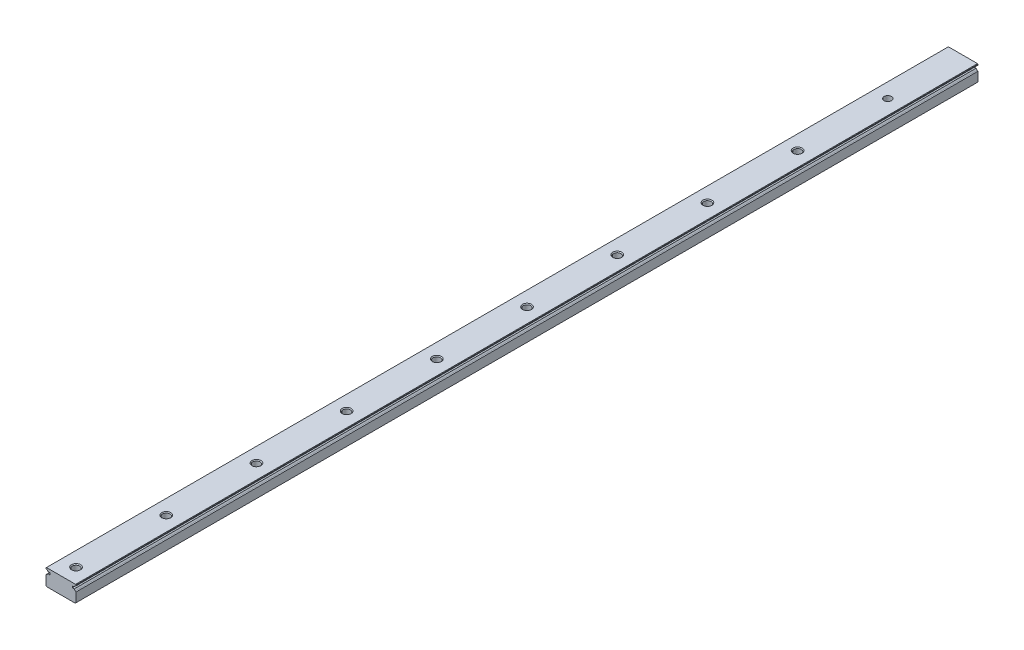
from build123d import *

# Parameters (mm, degrees)
ESQUISSE1_W                = 20
ESQUISSE1_H                = 600
BOSS_EXTRU_1_DEPTH         = 11
ENL_V_MAT_EXTRU_1_DEPTH    = 601.184138411
ENL_V_MAT_EXTRU_2_DEPTH    = 601.184138411
ENL_V_MAT_EXTRU_3_DEPTH    = 601.184138411
ENL_V_MAT_EXTRU_4_DEPTH    = 601.184138411
PER_AGE1_D                 = 4.917
PER_AGE2_D                 = 4.917
CHANFREIN1_SIZE            = 0.5415
CHANFREIN2_SIZE            = 0.3
R_P_TITION_LIN_AIRE1_COUNT = 9
R_P_TITION_LIN_AIRE1_PITCH = 60


with BuildPart() as part:
    # Esquisse1 → Boss.-Extru.1 (new body)
    with BuildSketch(Plane.XZ):
        with Locations((0, -50)):
            Rectangle(ESQUISSE1_W, ESQUISSE1_H)
    extrude(amount=-BOSS_EXTRU_1_DEPTH)

    # Esquisse2 → Enlèv. mat.-Extru.1 (cut, through all)
    with BuildSketch(Plane(origin=(0, 0, -350), x_dir=(-1, 0, 0), z_dir=(0, 0, -1))):
        with BuildLine():
            Line((10, 7.9), (10, 10.22385))
            Line((10, 10.22385), (9.440021531, 9.900556887))
            ThreePointArc((9.440021531, 9.900556887), (9.015681976, 9.557293765), (8.71772889, 9.1))
            Line((8.71772889, 9.1), (7.5, 9.1))
            Line((7.5, 9.1), (7.5, 7.9))
            Line((7.5, 7.9), (10, 7.9))
        make_face()
    extrude(amount=-ENL_V_MAT_EXTRU_1_DEPTH, mode=Mode.SUBTRACT)

    # Esquisse3 → Enlèv. mat.-Extru.2 (cut, through all)
    with BuildSketch(Plane(origin=(0, 0, -350), x_dir=(-1, 0, 0), z_dir=(0, 0, -1))):
        with BuildLine():
            Line((9.440021531, 7.099443113), (10, 6.77615))
            Line((10, 6.77615), (10, 7.9))
            Line((10, 7.9), (8.71772889, 7.9))
            ThreePointArc((8.71772889, 7.9), (9.015681976, 7.442706235), (9.440021531, 7.099443113))
        make_face()
    extrude(amount=-ENL_V_MAT_EXTRU_2_DEPTH, mode=Mode.SUBTRACT)

    # Esquisse4 → Enlèv. mat.-Extru.3 (cut, through all)
    with BuildSketch(Plane(origin=(0, 0, -350), x_dir=(-1, 0, 0), z_dir=(0, 0, -1))):
        with BuildLine():
            Line((-10, 9.1), (-10, 6.77615))
            Line((-10, 6.77615), (-9.440021531, 7.099443113))
            ThreePointArc((-9.440021531, 7.099443113), (-9.015681976, 7.442706235), (-8.71772889, 7.9))
            Line((-8.71772889, 7.9), (-7.5, 7.9))
            Line((-7.5, 7.9), (-7.5, 9.1))
            Line((-7.5, 9.1), (-10, 9.1))
        make_face()
    extrude(amount=-ENL_V_MAT_EXTRU_3_DEPTH, mode=Mode.SUBTRACT)

    # Esquisse5 → Enlèv. mat.-Extru.4 (cut, through all)
    with BuildSketch(Plane(origin=(0, 0, -350), x_dir=(-1, 0, 0), z_dir=(0, 0, -1))):
        with BuildLine():
            Line((-9.440021531, 9.900556887), (-10, 10.22385))
            Line((-10, 10.22385), (-10, 9.1))
            Line((-10, 9.1), (-8.71772889, 9.1))
            ThreePointArc((-8.71772889, 9.1), (-9.015681976, 9.557293765), (-9.440021531, 9.900556887))
        make_face()
    extrude(amount=-ENL_V_MAT_EXTRU_4_DEPTH, mode=Mode.SUBTRACT)

    # Perçage1 (through all)
    with Locations(Plane(origin=(0, 11, 0), x_dir=(1, 0, 0), z_dir=(0, 1, 0))):
        with Locations((0, -180), (0, -120), (0, 60), (0, 180)):
            Hole(PER_AGE1_D / 2)

    # Perçage2 (through all)
    with Locations(Plane(origin=(0, 0, 0), x_dir=(-1, 0, 0), z_dir=(0, -1, 0))):
        with Locations((0, -240), (0, -60), (0, 0), (0, 120), (0, 240)):
            per_age2 = Hole(PER_AGE2_D / 2)

    # Chanfrein1
    chanfrein1_edges = [part.edges().sort_by_distance(p)[0] for p in [
        (2.4585, 11, 180),
        (2.4585, 0, 180),
        (-2.4585, 0, -240),
        (-2.4585, 11, -240),
        (-2.4585, 0, -120),
        (-2.4585, 11, -120),
        (-2.4585, 0, 0),
        (-2.4585, 11, 0),
        (-2.4585, 0, 60),
        (-2.4585, 11, 60),
        (-2.4585, 0, 240),
        (-2.4585, 11, 240),
        (10, 0, -50),
        (-10, 0, -50),
        (2.4585, 11, -180),
        (2.4585, 0, -180),
        (2.4585, 11, -60),
        (2.4585, 0, -60),
        (2.4585, 11, 120),
        (2.4585, 0, 120),
    ]]
    chamfer(chanfrein1_edges, length=CHANFREIN1_SIZE)

    # Chanfrein2
    chanfrein2_edges = [part.edges().sort_by_distance(p)[0] for p in [
        (10, 11, -50),
        (-10, 11, -50),
    ]]
    chamfer(chanfrein2_edges, length=CHANFREIN2_SIZE)

    # Répétition linéaire1: Perçage2 ×9
    with Locations(*[(0, 0, -i * R_P_TITION_LIN_AIRE1_PITCH) for i in range(1, R_P_TITION_LIN_AIRE1_COUNT)]):
        add(per_age2, mode=Mode.SUBTRACT)


solid = part.part
